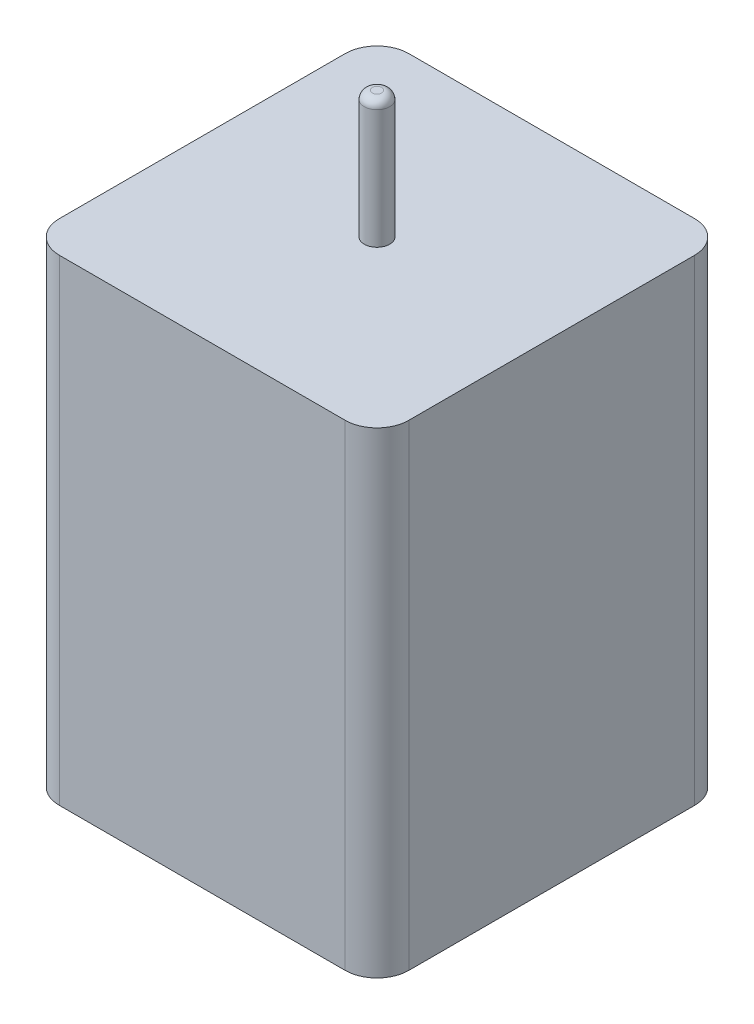
from build123d import *

# Parameters (mm, degrees)
SKETCH1_W           = 220
SKETCH1_H           = 220
BOSS_EXTRUDE1_DEPTH = 300
SKETCH2_R           = 8
BOSS_EXTRUDE2_DEPTH = 80
FILLET1_R           = 20
FILLET2_R           = 5


with BuildPart() as part:
    # Sketch1 → Boss-Extrude1 (new body)
    with BuildSketch(Plane(origin=(0, 0, 0), x_dir=(1, 0, 0), z_dir=(0, 1, 0))):
        Rectangle(SKETCH1_W, SKETCH1_H)
    extrude(amount=BOSS_EXTRUDE1_DEPTH)

    # Sketch2 → Boss-Extrude2 (add)
    with BuildSketch(Plane(origin=(0, 300, 0), x_dir=(1, 0, 0), z_dir=(0, 1, 0))):
        with Locations(Location((0, 0, 0), (0, 0, 90))):
            Circle(SKETCH2_R)
    extrude(amount=BOSS_EXTRUDE2_DEPTH)

    # Fillet1
    fillet1_edges = [part.edges().sort_by_distance(p)[0] for p in [
        (-110, 150, -110),
        (110, 150, -110),
        (110, 150, 110),
        (-110, 150, 110),
    ]]
    fillet(fillet1_edges, radius=FILLET1_R)

    # Fillet2
    fillet2_edges = [part.edges().sort_by_distance(p)[0] for p in [
        (0, 380, 8),
    ]]
    fillet(fillet2_edges, radius=FILLET2_R)


solid = part.part
